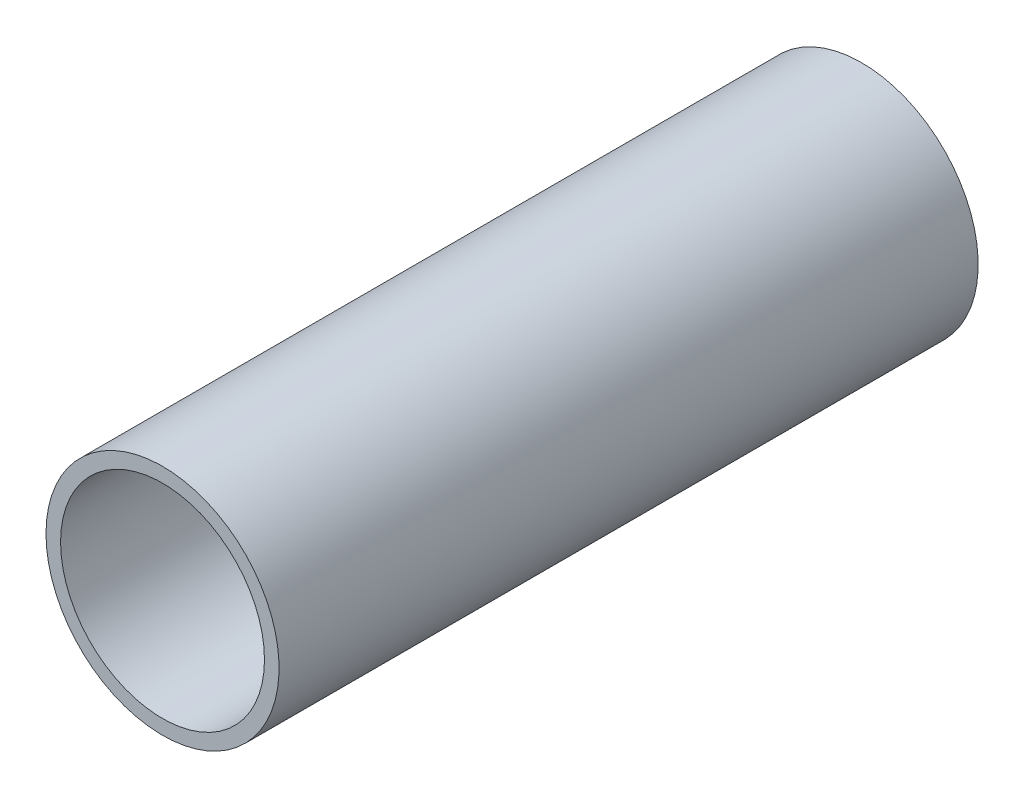
from build123d import *

# Parameters (mm, degrees)
SKETCH3_R           = 50.8
SKETCH3_R_2         = 44.45
BOSS_EXTRUDE1_DEPTH = 152.4


with BuildPart() as part:
    # Sketch3 → Boss-Extrude1 (new, symmetric)
    with BuildSketch(Plane.XY):
        with Locations(Location((0, 0, 0), (0, 0, 180))):
            Circle(SKETCH3_R)
        with Locations(Location((0, 0, 0), (0, 0, 180))):
            Circle(SKETCH3_R_2, mode=Mode.SUBTRACT)
    extrude(amount=BOSS_EXTRUDE1_DEPTH, both=True)


solid = part.part
